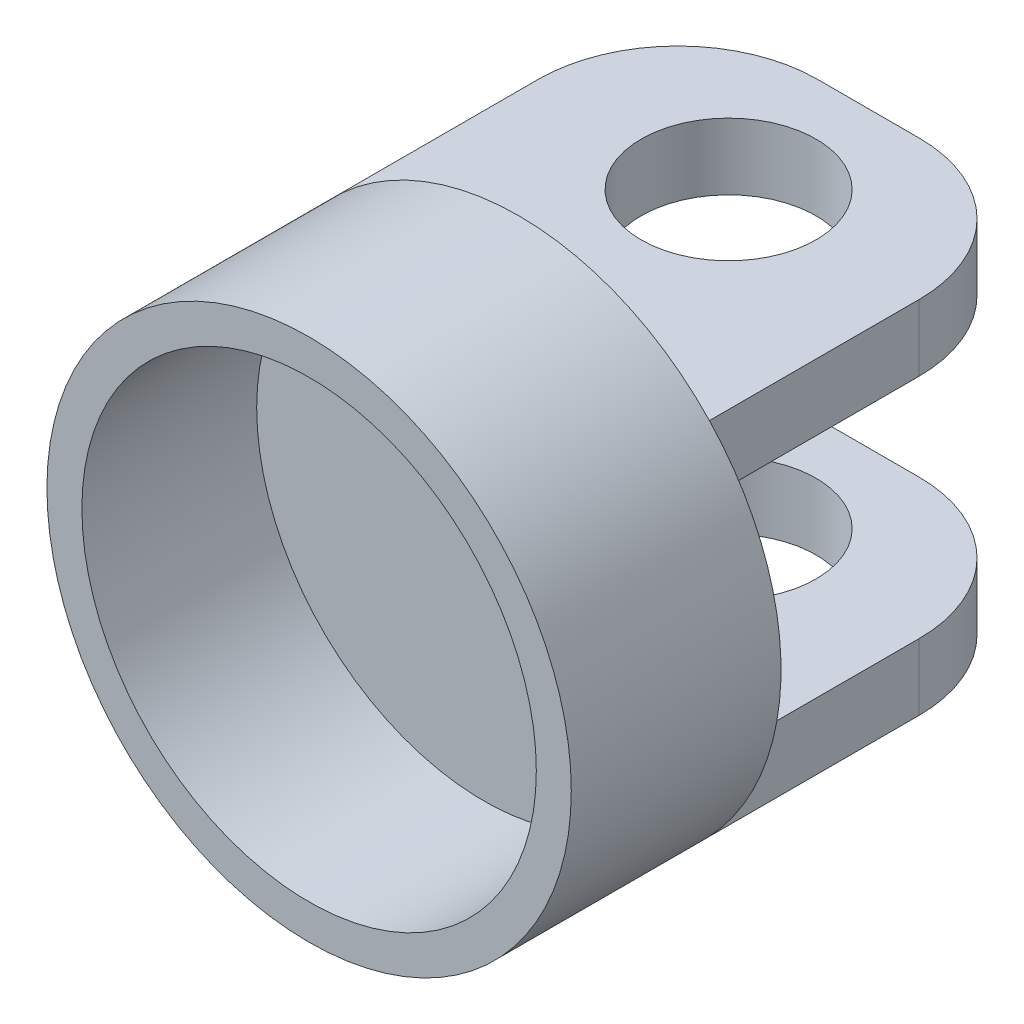
from build123d import *

# Parameters (mm, degrees)
SKETCH1_R           = 15
SKETCH1_R_2         = 13
BOSS_EXTRUDE1_DEPTH = 10
SKETCH1_2_R         = 15
SKETCH1_2_R_2       = 13
BOSS_EXTRUDE2_DEPTH = 10
BOSS_EXTRUDE3_START = 2
SKETCH2_R           = 15
BOSS_EXTRUDE3_DEPTH = 2
SKETCH3_W           = 21.803591486
SKETCH3_H           = 3.802953439
BOSS_EXTRUDE4_DEPTH = 20
FILLET1_R           = 8
CUT_EXTRUDE1_REACH  = 38.732
SKETCH4_R           = 5


with BuildPart() as part:
    # Sketch1 → Boss-Extrude1 (new body)
    with BuildSketch(Plane.XY):
        Circle(SKETCH1_R)
        Circle(SKETCH1_R_2, mode=Mode.SUBTRACT)
    extrude(amount=BOSS_EXTRUDE1_DEPTH)

    # Sketch1<2> → Boss-Extrude2 (add)
    with BuildSketch(Plane.XY):
        Circle(SKETCH1_2_R)
        Circle(SKETCH1_2_R_2, mode=Mode.SUBTRACT)
    extrude(amount=BOSS_EXTRUDE2_DEPTH)

    # Sketch2 → Boss-Extrude3 (add)
    with BuildSketch(Plane(origin=(0, 0, 0), x_dir=(-1, 0, 0), z_dir=(0, 0, -1)).offset(BOSS_EXTRUDE3_START)):
        Circle(SKETCH2_R)
    extrude(amount=-BOSS_EXTRUDE3_DEPTH)

    # Sketch3 → Boss-Extrude4 (add)
    with BuildSketch(Plane(origin=(0, 0, -2), x_dir=(-1, 0, 0), z_dir=(0, 0, -1))):
        with Locations((0, -8.401476719)):
            Rectangle(SKETCH3_W, SKETCH3_H)
        with Locations((0, 8.401476719)):
            Rectangle(SKETCH3_W, SKETCH3_H)
    extrude(amount=BOSS_EXTRUDE4_DEPTH)

    # Fillet1
    fillet1_edges = [part.edges().sort_by_distance(p)[0] for p in [
        (-10.901795743, -8.40147672, -22),
        (10.901795743, -8.40147672, -22),
        (10.901795743, 8.40147672, -22),
        (-10.901795743, 8.40147672, -22),
    ]]
    fillet(fillet1_edges, radius=FILLET1_R)

    # Cut-Extrude1: up to this face of the body (flat: up to its plane)
    cut_extrude1_end = Plane(part.part.faces().sort_by_distance((0, -10.302953439, -11.447862962))[0])
    # Sketch4 → Cut-Extrude1 (cut, up to the picked face)
    with BuildSketch(Plane(origin=(0, 10.302953439, 0), x_dir=(1, 0, 0), z_dir=(0, 1, 0)), mode=Mode.PRIVATE) as cut_extrude1_sk1:
        with Locations(Location((0, 14, 0), (0, 0, 270))):
            Circle(SKETCH4_R)
    cut_extrude1_tool1 = split(extrude(cut_extrude1_sk1.sketch, amount=-CUT_EXTRUDE1_REACH, mode=Mode.PRIVATE), bisect_by=cut_extrude1_end, keep=Keep.BOTH, mode=Mode.PRIVATE)
    add(cut_extrude1_tool1.solids().sort_by(Axis((0, 10.302953, -14), (0, -1, 0)))[0], mode=Mode.SUBTRACT)


solid = part.part
